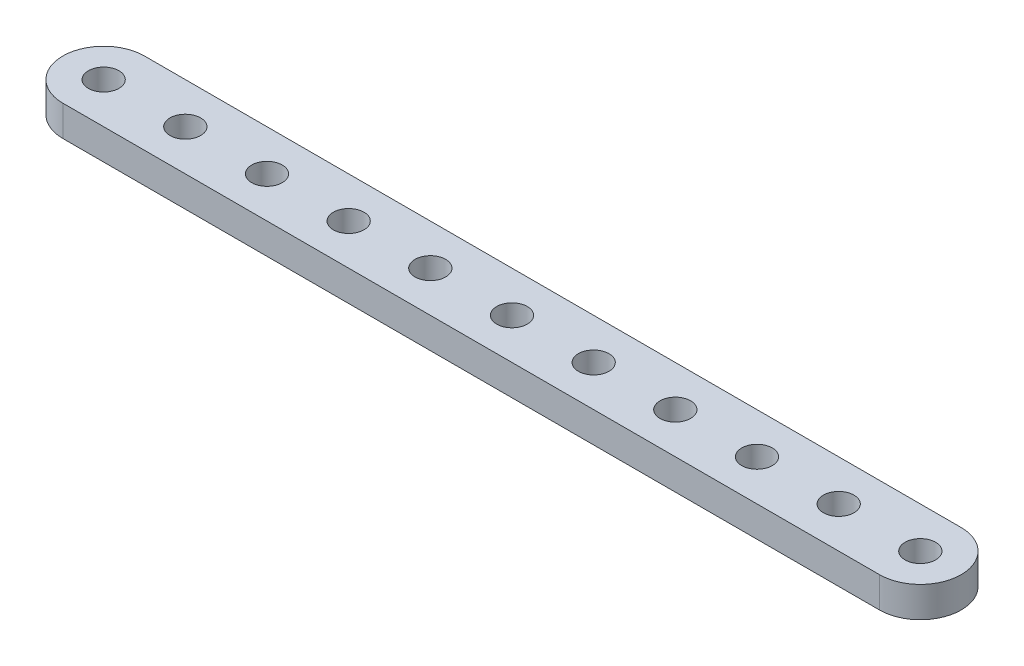
from build123d import *

# Parameters (mm, degrees)
SKETCH2_R           = 1.5
BOSS_EXTRUDE2_DEPTH = 3


with BuildPart() as part:
    # Sketch2 → Boss-Extrude2 (new body)
    with BuildSketch(Plane(origin=(0, 0, 0), x_dir=(1, 0, 0), z_dir=(0, 1, 0))):
        with BuildLine():
            Line((0, 4), (80, 4))
            ThreePointArc((80, 4), (84, 0), (80, -4))
            Line((80, -4), (0, -4))
            ThreePointArc((0, -4), (-4, 0), (0, 4))
        make_face()
        with Locations(Location((0, 0, 0), (0, 0, 270))):
            Circle(SKETCH2_R, mode=Mode.SUBTRACT)
        with Locations(Location((8, 0, 0), (0, 0, 270))):
            Circle(SKETCH2_R, mode=Mode.SUBTRACT)
        with Locations(Location((16, 0, 0), (0, 0, 270))):
            Circle(SKETCH2_R, mode=Mode.SUBTRACT)
        with Locations(Location((24, 0, 0), (0, 0, 270))):
            Circle(SKETCH2_R, mode=Mode.SUBTRACT)
        with Locations(Location((32, 0, 0), (0, 0, 270))):
            Circle(SKETCH2_R, mode=Mode.SUBTRACT)
        with Locations(Location((40, 0, 0), (0, 0, 270))):
            Circle(SKETCH2_R, mode=Mode.SUBTRACT)
        with Locations(Location((48, 0, 0), (0, 0, 270))):
            Circle(SKETCH2_R, mode=Mode.SUBTRACT)
        with Locations(Location((56, 0, 0), (0, 0, 270))):
            Circle(SKETCH2_R, mode=Mode.SUBTRACT)
        with Locations(Location((64, 0, 0), (0, 0, 270))):
            Circle(SKETCH2_R, mode=Mode.SUBTRACT)
        with Locations(Location((72, 0, 0), (0, 0, 270))):
            Circle(SKETCH2_R, mode=Mode.SUBTRACT)
        with Locations(Location((80, 0, 0), (0, 0, 270))):
            Circle(SKETCH2_R, mode=Mode.SUBTRACT)
    extrude(amount=BOSS_EXTRUDE2_DEPTH)


solid = part.part
